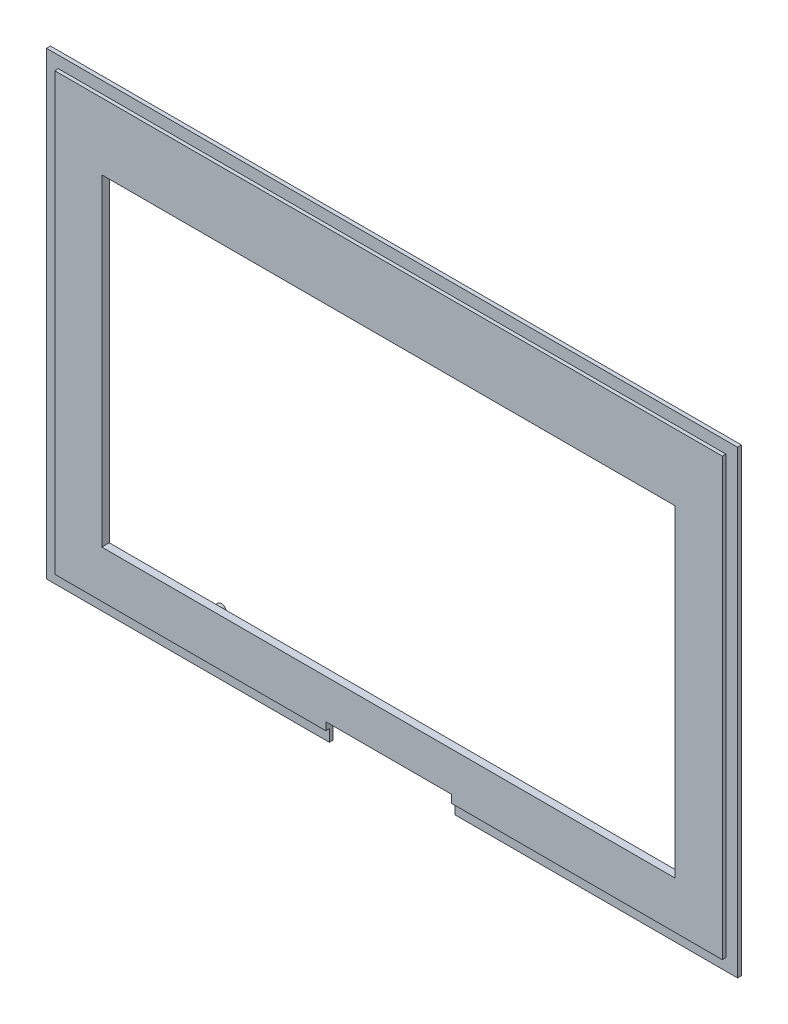
from build123d import *

# Parameters (mm, degrees)
ESBO_O1_W                = 170.2
ESBO_O1_H                = 111.2
RESSALTO_EXTRUS_O1_DEPTH = 0.9
ESBO_O4_W                = 176.2
ESBO_O4_H                = 117.2
RESSALTO_EXTRUS_O3_DEPTH = 1
ESBO_O5_W                = 32
ESBO_O5_H                = 1.9
CORTE_EXTRUS_O3_DEPTH    = 5
ESBO_O6_R                = 1.25
RESSALTO_EXTRUS_O4_DEPTH = 2.5
ESBO_O10_W               = 13
ESBO_O10_H               = 4
CORTE_EXTRUS_O6_DEPTH    = 1.1
ESBO_O12_W               = 146.2
ESBO_O12_H               = 82.2
CORTE_EXTRUS_O8_DEPTH    = 10


with BuildPart() as part:
    # Esboço1 → Ressalto-extrusão1 (new body)
    with BuildSketch(Plane.XY):
        with Locations((91, 62.6)):
            Rectangle(ESBO_O1_W, ESBO_O1_H)
    extrude(amount=RESSALTO_EXTRUS_O1_DEPTH)

    # Esboço4 → Ressalto-extrusão3 (add)
    with BuildSketch(Plane(origin=(0, 0, 0), x_dir=(-1, 0, 0), z_dir=(0, 0, -1))):
        with Locations((-91, 62.6)):
            Rectangle(ESBO_O4_W, ESBO_O4_H)
    extrude(amount=RESSALTO_EXTRUS_O3_DEPTH)

    # Esboço5 → Corte-extrusão3 (cut)
    with BuildSketch(Plane.XZ.offset(-4)):
        with Locations((91, -0.05)):
            Rectangle(ESBO_O5_W, ESBO_O5_H)
    extrude(amount=-CORTE_EXTRUS_O3_DEPTH, mode=Mode.SUBTRACT)

    # Esboço6 → Ressalto-extrusão4 (add)
    with BuildSketch(Plane(origin=(0, 0, -1), x_dir=(-1, 0, 0), z_dir=(0, 0, -1))):
        with Locations((-108.3, 14.75)):
            Circle(ESBO_O6_R)
        with Locations((-108.3, 106.45)):
            Circle(ESBO_O6_R)
        with Locations((-43.3, 106.45)):
            Circle(ESBO_O6_R)
        with Locations((-44, 16.15)):
            Circle(ESBO_O6_R)
    extrude(amount=RESSALTO_EXTRUS_O4_DEPTH)

    # Esboço10 → Corte-extrusão6 (cut)
    with BuildSketch(Plane(origin=(0, 0, -1), x_dir=(-1, 0, 0), z_dir=(0, 0, -1))):
        with Locations((-52.05, 106.45)):
            Rectangle(ESBO_O10_W, ESBO_O10_H)
    extrude(amount=-CORTE_EXTRUS_O6_DEPTH, mode=Mode.SUBTRACT)

    # Esboço12 → Corte-extrusão8 (cut)
    with BuildSketch(Plane.XY.offset(0.9)):
        with Locations((91, 60.1)):
            Rectangle(ESBO_O12_W, ESBO_O12_H)
    extrude(amount=-CORTE_EXTRUS_O8_DEPTH, mode=Mode.SUBTRACT)


solid = part.part
